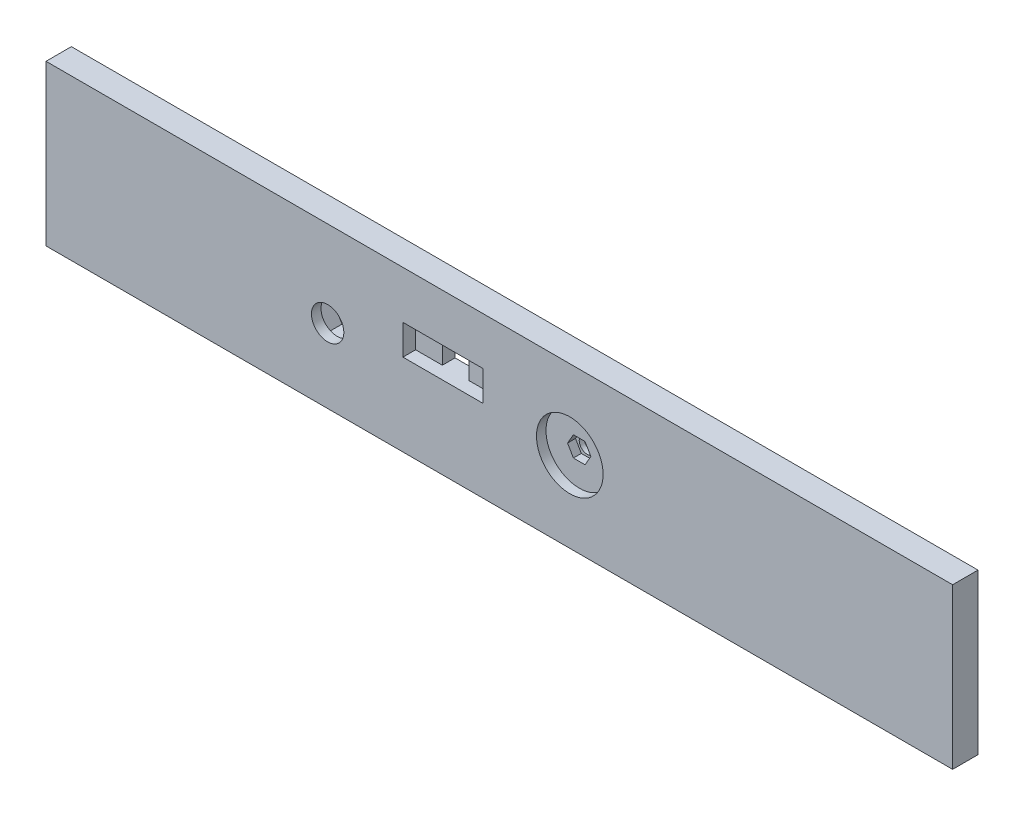
from build123d import *

# Parameters (mm, degrees)
SKETCH1_W                  = 571.5
SKETCH1_H                  = 100.8
BOSS_EXTRUDE1_DEPTH        = 8
SKETCH4_R                  = 7.5
CUT_EXTRUDE3_DEPTH         = 2
SKETCH5_R                  = 5
CUT_EXTRUDE4_DEPTH         = 581.490215249
CUT_EXTRUDE5_DEPTH         = 11
SKETCH9_R                  = 10.2
POWER_AND_USB_CABLES_DEPTH = 581.541893406
SKETCH10_R                 = 21
CUT_EXTRUDE6_DEPTH         = 6
CUT_EXTRUDE8_DEPTH         = 10
CUT_EXTRUDE9_DEPTH         = 581.541893406
CUT_EXTRUDE9_DEPTH_BACK    = 581.541893406
SKETCH13_W                 = 16.7
SKETCH13_H                 = 19
SKETCH14_W                 = 50.4
SKETCH14_H                 = 19
CUT_EXTRUDE10_DEPTH        = 8
SKETCH15_R                 = 15
CUT_EXTRUDE11_DEPTH        = 2


with BuildPart() as part:
    # Sketch1 → Boss-Extrude1 (new, symmetric)
    with BuildSketch(Plane.XY):
        with Locations((285.75, 50.4)):
            Rectangle(SKETCH1_W, SKETCH1_H)
    extrude(amount=BOSS_EXTRUDE1_DEPTH, both=True)

    # Sketch4 → Cut-Extrude3 (cut)
    with BuildSketch(Plane(origin=(0, 0, -8), x_dir=(-1, 0, 0), z_dir=(0, 0, -1))):
        with Locations((-330.123617772, 50.8)):
            Circle(SKETCH4_R)
    extrude(amount=-CUT_EXTRUDE3_DEPTH, mode=Mode.SUBTRACT)

    # Sketch5 → Cut-Extrude4 (cut, through all)
    with BuildSketch(Plane(origin=(0, 0, -6), x_dir=(-1, 0, 0), z_dir=(0, 0, -1))):
        with Locations((-330.123617772, 50.8)):
            Circle(SKETCH5_R)
    extrude(amount=-CUT_EXTRUDE4_DEPTH, mode=Mode.SUBTRACT)

    # Sketch6 → Cut-Extrude5 (cut)
    with BuildSketch(Plane.XY.offset(8)):
        Polygon((337.467513196, 50.8), (333.795565484, 57.16), (326.45167006, 57.16), (322.779722348, 50.8), (326.45167006, 44.44), (333.795565484, 44.44), align=None)
    extrude(amount=-CUT_EXTRUDE5_DEPTH, mode=Mode.SUBTRACT)

    # Sketch9 → power and usb cables (cut, through all)
    with BuildSketch(Plane.XY.offset(8)):
        with Locations((177.536724471, 46.600039321)):
            Circle(SKETCH9_R)
    extrude(amount=-POWER_AND_USB_CABLES_DEPTH, mode=Mode.SUBTRACT)

    # Sketch10 → Cut-Extrude6 (cut)
    with BuildSketch(Plane.XY.offset(8)):
        with Locations((330.16394587, 50.821844921)):
            Circle(SKETCH10_R)
    extrude(amount=-CUT_EXTRUDE6_DEPTH, mode=Mode.SUBTRACT)

    # Sketch12 → Cut-Extrude8 (cut)
    with BuildSketch(Plane(origin=(0, 0, -8), x_dir=(-1, 0, 0), z_dir=(0, 0, -1))):
        Polygon((-163.68031801, 46.600039321), (-170.608521241, 58.600039321), (-184.464927701, 58.600039321), (-191.393130932, 46.600039321), (-184.464927701, 34.600039321), (-170.608521241, 34.600039321), align=None)
    extrude(amount=-CUT_EXTRUDE8_DEPTH, mode=Mode.SUBTRACT)

    # Sketch13 → Cut-Extrude9 (cut, two sides: drawn at the far end of the back side and taken through both)
    with BuildSketch(Plane(origin=(0, 0, -8), x_dir=(-1, 0, 0), z_dir=(0, 0, -1)).offset(-CUT_EXTRUDE9_DEPTH_BACK)):
        with Locations((-250.2, 61.3)):
            Rectangle(SKETCH13_W, SKETCH13_H)
    extrude(amount=CUT_EXTRUDE9_DEPTH + CUT_EXTRUDE9_DEPTH_BACK, mode=Mode.SUBTRACT)

    # Sketch14 → Cut-Extrude10 (cut)
    with BuildSketch(Plane.XY.offset(8)):
        with Locations((250.2, 61.3)):
            Rectangle(SKETCH14_W, SKETCH14_H)
    extrude(amount=-CUT_EXTRUDE10_DEPTH, mode=Mode.SUBTRACT)

    # Sketch15 → Cut-Extrude11 (cut)
    with BuildSketch(Plane(origin=(0, 0, -8), x_dir=(-1, 0, 0), z_dir=(0, 0, -1))):
        with Locations((-330.16394587, 50.821844921)):
            Circle(SKETCH15_R)
    extrude(amount=-CUT_EXTRUDE11_DEPTH, mode=Mode.SUBTRACT)


solid = part.part
